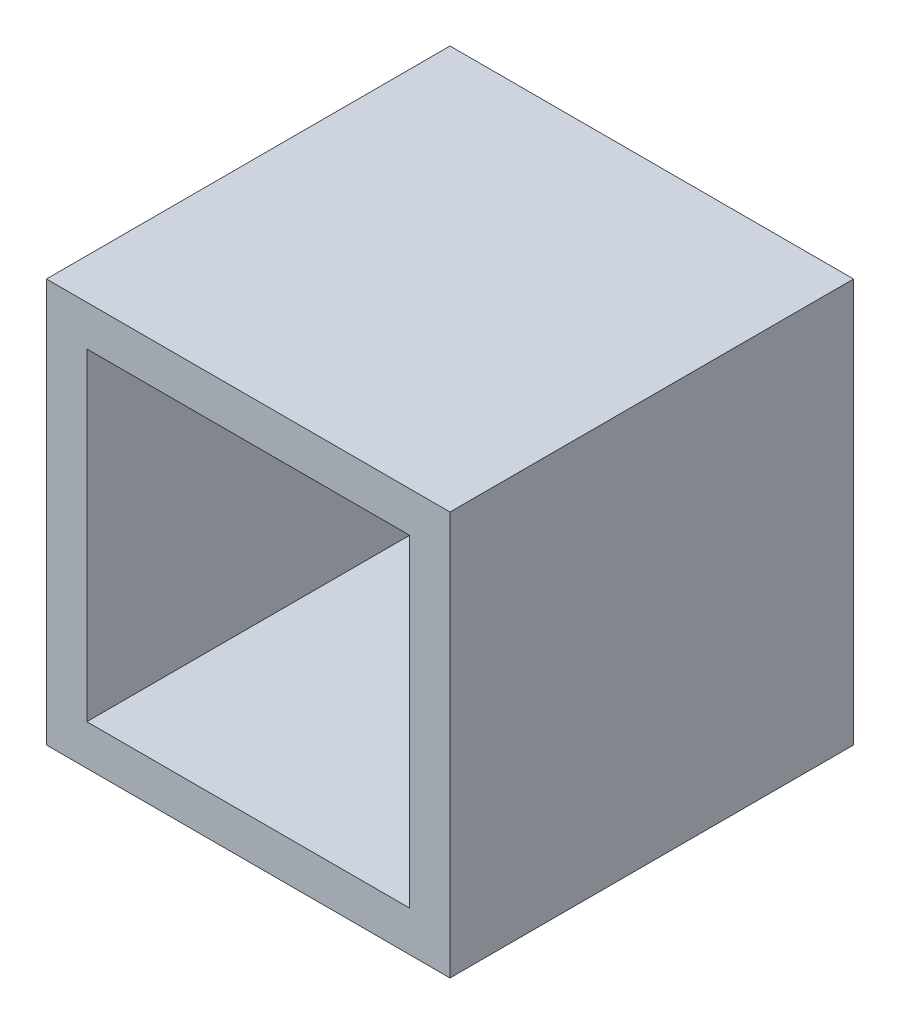
from build123d import *

# Parameters (mm, degrees)
SKETCH1_W           = 10
SKETCH1_H           = 10
BOSS_EXTRUDE1_DEPTH = 10
SHELL1_T            = -1


with BuildPart() as part:
    # Sketch1 → Boss-Extrude1 (new body)
    with BuildSketch(Plane.XY):
        with Locations((5, 5)):
            Rectangle(SKETCH1_W, SKETCH1_H)
    extrude(amount=BOSS_EXTRUDE1_DEPTH)

    # Shell1
    shell1_openings = [part.faces().sort_by_distance(p)[0] for p in [
        (5, 5, 10),
    ]]
    offset(amount=SHELL1_T, openings=shell1_openings, kind=Kind.INTERSECTION)


solid = part.part
